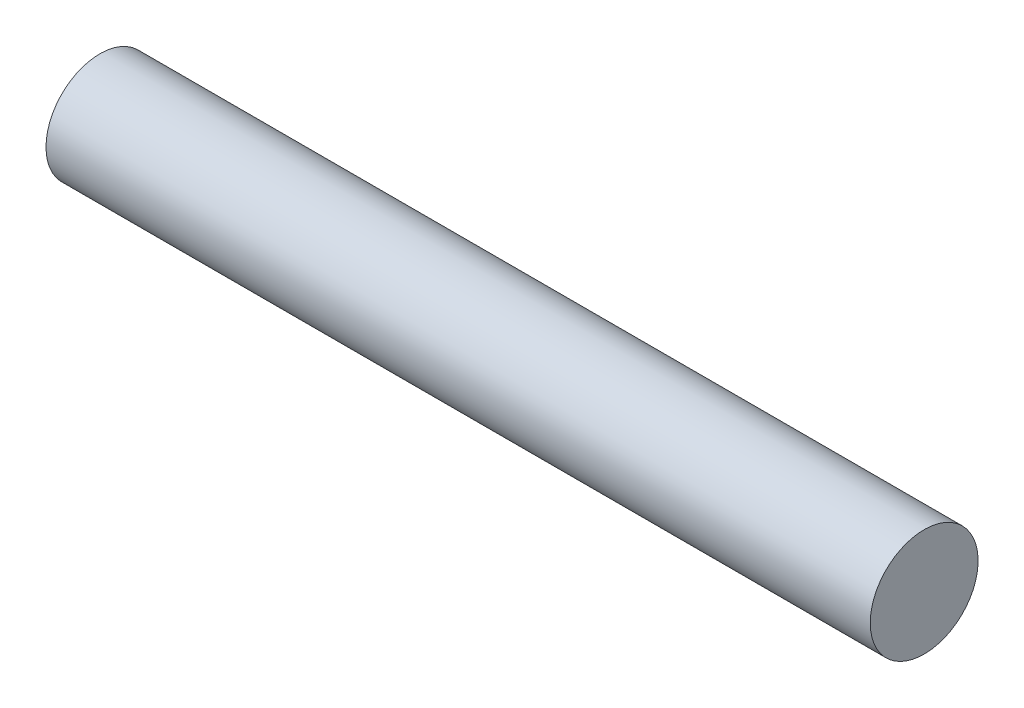
from build123d import *

# Parameters (mm, degrees)
SKETCH_1_W = 107
SKETCH_1_H = 7


with BuildPart() as part:
    # 草图1 → 旋转1 (revolve)
    with BuildSketch(Plane.XY, mode=Mode.PRIVATE) as revolve_1_sk:
        with Locations((53.5, 3.5)):
            Rectangle(SKETCH_1_W, SKETCH_1_H)
    revolve(revolve_1_sk.sketch.rotate(Axis((0, 0, 0), (1, 0, 0)), 90), axis=Axis((0, 0, 0), (1, 0, 0)))


solid = part.part
